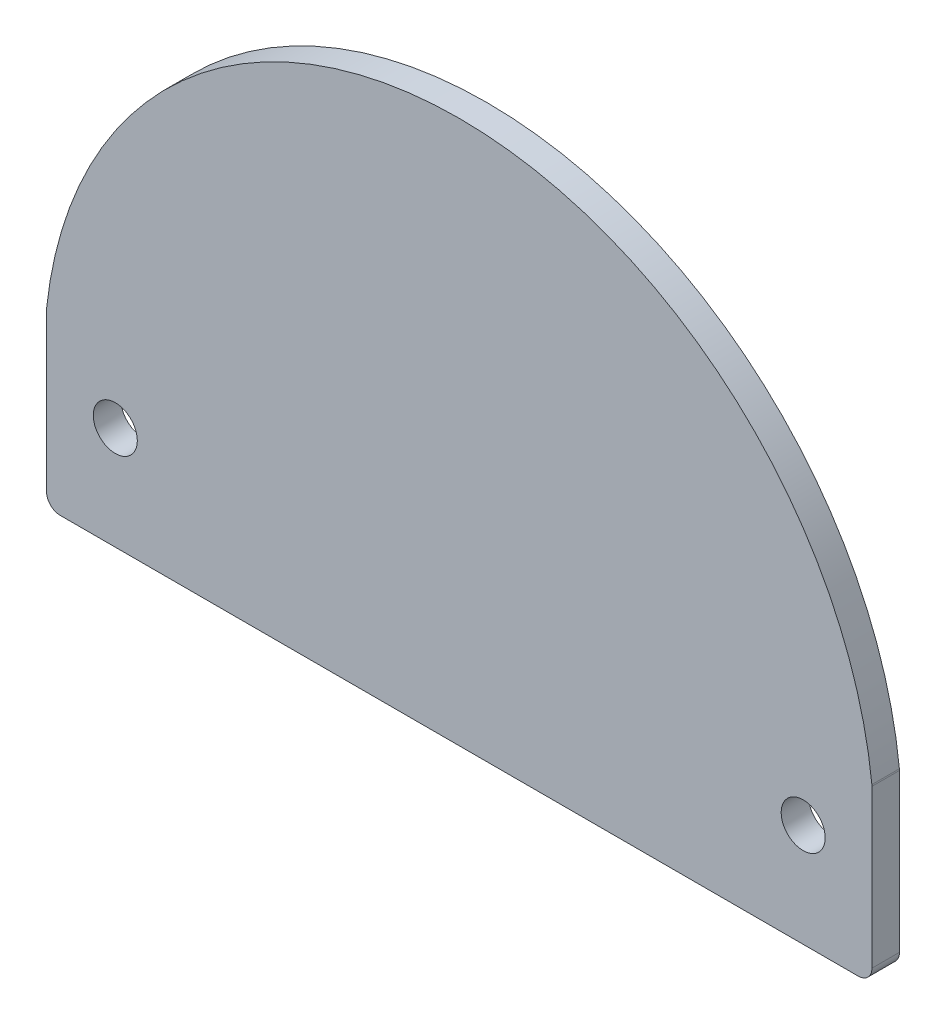
from build123d import *

# Parameters (mm, degrees)
EXTRUDE_367_DEPTH          = 2
CUT_EXTRUDE_570_DEPTH      = 41.410394702
CUT_EXTRUDE_570_DEPTH_BACK = 41.410394702
SKETCH_2_R                 = 1.6
FILLET_1_R                 = 1


with BuildPart() as part:
    # Эскиз1 → Extrude 367 (new body)
    with BuildSketch(Plane.XY):
        with BuildLine():
            Line((-30, 0), (-30, -12.5))
            Line((-30, -12.5), (30, -12.5))
            Line((30, -12.5), (30, 0))
            ThreePointArc((30, 0), (0, 27), (-30, 0))
        make_face()
    extrude(amount=EXTRUDE_367_DEPTH)

    # Эскиз2 → Cut-Extrude 570 (cut, two sides: drawn at the far end of the back side and taken through both)
    with BuildSketch(Plane.XY.offset(2).offset(-CUT_EXTRUDE_570_DEPTH_BACK)):
        with Locations((-25, -5)):
            Circle(SKETCH_2_R)
        with Locations((25, -5)):
            Circle(SKETCH_2_R)
    extrude(amount=CUT_EXTRUDE_570_DEPTH + CUT_EXTRUDE_570_DEPTH_BACK, mode=Mode.SUBTRACT)

    # Скругление1
    fillet_1_edges = [part.edges().sort_by_distance(p)[0] for p in [
        (30, 0, 1),
        (30, -12.5, 1),
        (-30, -12.5, 1),
        (-30, 0, 1),
    ]]
    fillet(fillet_1_edges, radius=FILLET_1_R)


solid = part.part
